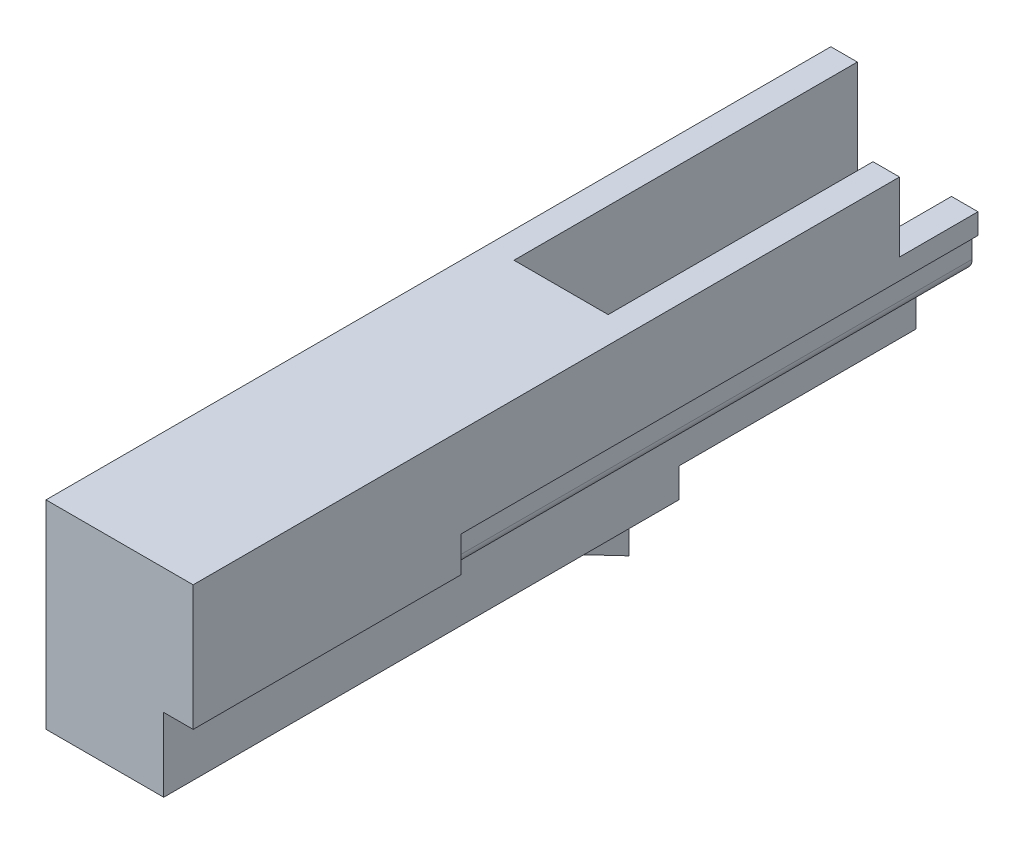
from build123d import *

# Parameters (mm, degrees)
SKETCH1_W           = 50
SKETCH1_H           = 86.52
BOSS_EXTRUDE1_DEPTH = 266.658
SKETCH2_W           = 32
SKETCH2_H           = 116.66
CUT_EXTRUDE1_DEPTH  = 39.55
SKETCH3_W           = 32
SKETCH3_H           = 11
CUT_EXTRUDE2_DEPTH  = 276.341006506
SKETCH4_W           = 23
SKETCH4_H           = 33
CUT_EXTRUDE3_DEPTH  = 276.341006506
SKETCH5_W           = 19
SKETCH5_H           = 52
CUT_EXTRUDE4_DEPTH  = 276.341006506
SKETCH6_W           = 19
SKETCH6_H           = 3
CUT_EXTRUDE5_DEPTH  = 3
SKETCH7_W           = 26.66
SKETCH7_H           = 23.55
CUT_EXTRUDE6_DEPTH  = 11
SKETCH8_W           = 96.66
SKETCH8_H           = 18.97
CUT_EXTRUDE7_DEPTH  = 285.76692112
SKETCH9_W           = 80.656
SKETCH9_H           = 10
CUT_EXTRUDE8_DEPTH  = 285.76692112
SKETCH10_W          = 11
SKETCH10_H          = 25
CUT_EXTRUDE9_DEPTH  = 285.76692112
SKETCH11_W          = 175.66
SKETCH11_H          = 55.97
CUT_EXTRUDE10_DEPTH = 2
SKETCH12_W          = 266.658
SKETCH12_H          = 59.418393815
CUT_EXTRUDE11_DEPTH = 10
FILLET2_R           = 4
SKETCH13_W          = 19
SKETCH13_H          = 48.117373491
CUT_EXTRUDE12_DEPTH = 2.659
SKETCH16_W          = 19
SKETCH16_H          = 23.032
CUT_EXTRUDE13_DEPTH = 0.341
CUT_EXTRUDE14_DEPTH = 284.182272334
CUT_EXTRUDE15_DEPTH = 10
SKETCH22_W          = 5.5
SKETCH22_H          = 5.004
CUT_EXTRUDE16_DEPTH = 0.03
SKETCH24_W          = 4.5
SKETCH24_H          = 85.486763268
BOSS_EXTRUDE2_DEPTH = 0.03


with BuildPart() as part:
    # Sketch1 → Boss-Extrude1 (new body)
    with BuildSketch(Plane.XY):
        with Locations((-25, 43.26)):
            Rectangle(SKETCH1_W, SKETCH1_H)
    extrude(amount=BOSS_EXTRUDE1_DEPTH)

    # Sketch2 → Cut-Extrude1 (cut)
    with BuildSketch(Plane(origin=(0, 86.52, 0), x_dir=(1, 0, 0), z_dir=(0, 1, 0))):
        with Locations((-25, -58.33)):
            Rectangle(SKETCH2_W, SKETCH2_H)
    extrude(amount=-CUT_EXTRUDE1_DEPTH, mode=Mode.SUBTRACT)

    # Sketch3 → Cut-Extrude2 (cut, through all)
    with BuildSketch(Plane(origin=(0, 46.97, 0), x_dir=(1, 0, 0), z_dir=(0, 1, 0))):
        with Locations((-25, -5.5)):
            Rectangle(SKETCH3_W, SKETCH3_H)
    extrude(amount=-CUT_EXTRUDE2_DEPTH, mode=Mode.SUBTRACT)

    # Sketch4 → Cut-Extrude3 (cut, through all)
    with BuildSketch(Plane(origin=(0, 46.97, 0), x_dir=(1, 0, 0), z_dir=(0, 1, 0))):
        with Locations((-25, -27.5)):
            Rectangle(SKETCH4_W, SKETCH4_H)
    extrude(amount=-CUT_EXTRUDE3_DEPTH, mode=Mode.SUBTRACT)

    # Sketch5 → Cut-Extrude4 (cut, through all)
    with BuildSketch(Plane(origin=(0, 46.97, 0), x_dir=(1, 0, 0), z_dir=(0, 1, 0))):
        with Locations((-25, -70)):
            Rectangle(SKETCH5_W, SKETCH5_H)
    extrude(amount=-CUT_EXTRUDE4_DEPTH, mode=Mode.SUBTRACT)

    # Sketch6 → Cut-Extrude5 (cut)
    with BuildSketch(Plane(origin=(0, 46.97, 0), x_dir=(1, 0, 0), z_dir=(0, 1, 0))):
        with Locations((-25, -97.5)):
            Rectangle(SKETCH6_W, SKETCH6_H)
    extrude(amount=-CUT_EXTRUDE5_DEPTH, mode=Mode.SUBTRACT)

    # Sketch7 → Cut-Extrude6 (cut)
    with BuildSketch(Plane(origin=(0, 0, 0), x_dir=(0, 0, -1), z_dir=(1, 0, 0))):
        with Locations((-13.33, 74.745)):
            Rectangle(SKETCH7_W, SKETCH7_H)
    extrude(amount=-CUT_EXTRUDE6_DEPTH, mode=Mode.SUBTRACT)

    # Sketch8 → Cut-Extrude7 (cut, through all)
    with BuildSketch(Plane(origin=(0, 0, 0), x_dir=(0, 0, -1), z_dir=(1, 0, 0))):
        with Locations((-48.33, 9.485)):
            Rectangle(SKETCH8_W, SKETCH8_H)
    extrude(amount=-CUT_EXTRUDE7_DEPTH, mode=Mode.SUBTRACT)

    # Sketch9 → Cut-Extrude8 (cut, through all)
    with BuildSketch(Plane(origin=(0, 0, 0), x_dir=(0, 0, -1), z_dir=(1, 0, 0))):
        with Locations((-51.328, 23.97)):
            Rectangle(SKETCH9_W, SKETCH9_H)
    extrude(amount=-CUT_EXTRUDE8_DEPTH, mode=Mode.SUBTRACT)

    # Sketch10 → Cut-Extrude9 (cut, through all)
    with BuildSketch(Plane(origin=(0, 0, 0), x_dir=(0, 0, -1), z_dir=(1, 0, 0))):
        with Locations((-5.5, 31.47)):
            Rectangle(SKETCH10_W, SKETCH10_H)
    extrude(amount=-CUT_EXTRUDE9_DEPTH, mode=Mode.SUBTRACT)

    # Sketch11 → Cut-Extrude10 (cut)
    with BuildSketch(Plane(origin=(0, 0, 0), x_dir=(0, 0, -1), z_dir=(1, 0, 0))):
        with Locations((-87.83, 27.985)):
            Rectangle(SKETCH11_W, SKETCH11_H)
    extrude(amount=-CUT_EXTRUDE10_DEPTH, mode=Mode.SUBTRACT)

    # Sketch12 → Cut-Extrude11 (cut)
    with BuildSketch(Plane(origin=(0, 0, 0), x_dir=(0, 0, -1), z_dir=(1, 0, 0))):
        with Locations((-133.329, 14.260803093)):
            Rectangle(SKETCH12_W, SKETCH12_H)
    extrude(amount=-CUT_EXTRUDE11_DEPTH, mode=Mode.SUBTRACT)

    # Fillet2
    fillet2_edges = [part.edges().sort_by_distance(p)[0] for p in [
        (-2, 43.97, 87.83),
    ]]
    fillet(fillet2_edges, radius=FILLET2_R)

    # Sketch13 → Cut-Extrude12 (cut)
    with BuildSketch(Plane(origin=(0, 0, 96), x_dir=(-1, 0, 0), z_dir=(0, 0, -1))):
        with Locations((25, 15.911313255)):
            Rectangle(SKETCH13_W, SKETCH13_H)
    extrude(amount=-CUT_EXTRUDE12_DEPTH, mode=Mode.SUBTRACT)

    # Sketch16 → Cut-Extrude13 (cut)
    with BuildSketch(Plane(origin=(0, 0, 98.659), x_dir=(-1, 0, 0), z_dir=(0, 0, -1))):
        with Locations((25, 28.454)):
            Rectangle(SKETCH16_W, SKETCH16_H)
    extrude(amount=-CUT_EXTRUDE13_DEPTH, mode=Mode.SUBTRACT)

    # Sketch18 → Cut-Extrude14 (cut, through all)
    with BuildSketch(Plane(origin=(-10, 0, 0), x_dir=(0, 0, -1), z_dir=(1, 0, 0))):
        Polygon((-133.131, 19), (-96.66, 0), (-266.658, 0), (-266.658, 19), align=None)
    extrude(amount=-CUT_EXTRUDE14_DEPTH, mode=Mode.SUBTRACT)

    # Sketch19 → Cut-Extrude15 (cut)
    with BuildSketch(Plane(origin=(-10, 0, 0), x_dir=(0, 0, -1), z_dir=(1, 0, 0))):
        Polygon((-96.66, 0), (-133.131, 19), (-96.66, 19), align=None)
    extrude(amount=-CUT_EXTRUDE15_DEPTH, mode=Mode.SUBTRACT)

    # Sketch22 → Cut-Extrude16 (cut)
    with BuildSketch(Plane.XZ.offset(-18.97)):
        with Locations((-12.75, 94.158)):
            Rectangle(SKETCH22_W, SKETCH22_H)
    extrude(amount=-CUT_EXTRUDE16_DEPTH, mode=Mode.SUBTRACT)

    # Sketch24 → Boss-Extrude2 (add)
    with BuildSketch(Plane.XZ.offset(-19)):
        with Locations((-17.75, 141.743381634)):
            Rectangle(SKETCH24_W, SKETCH24_H)
    extrude(amount=BOSS_EXTRUDE2_DEPTH)


solid = part.part
